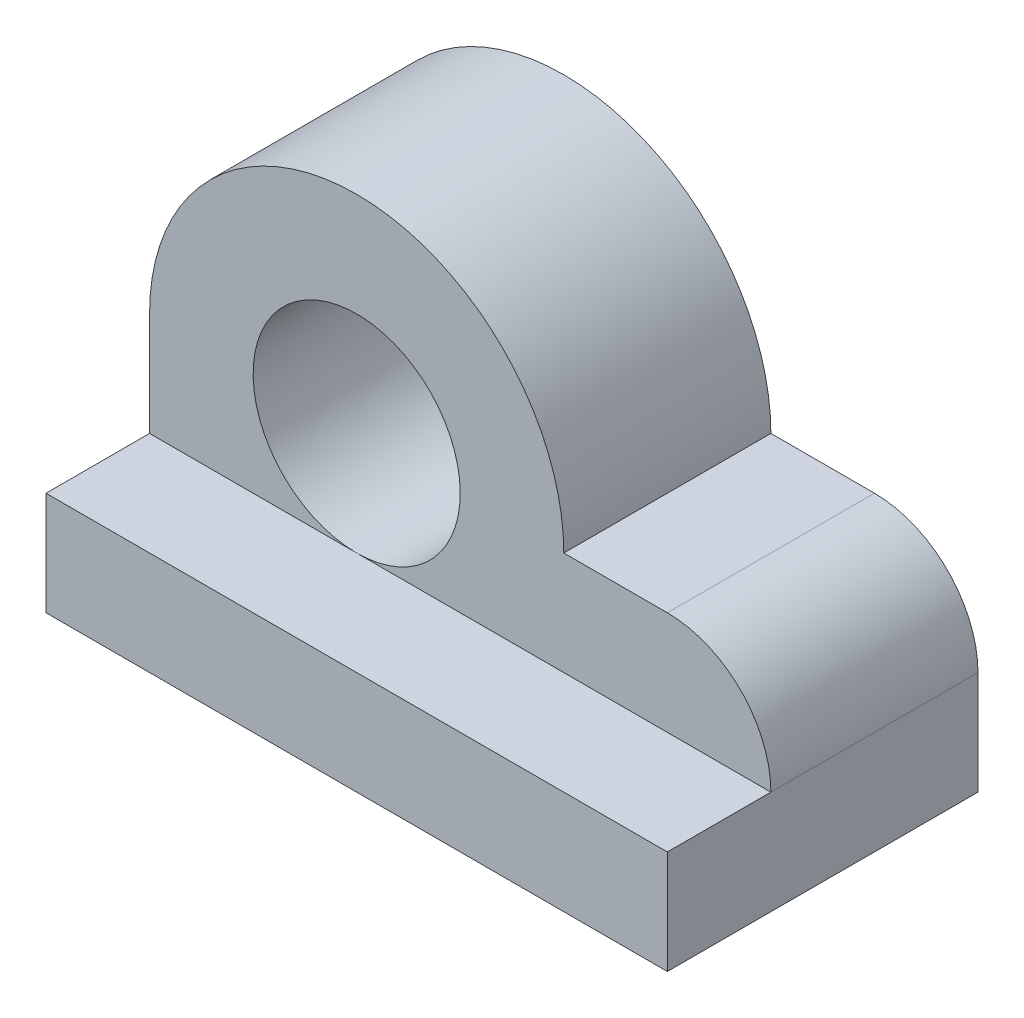
from build123d import *

# Parameters (mm, degrees)
SKETCH_1_W          = 60
SKETCH_1_H          = 10
EXTRUDE_1_DEPTH     = 30
SKETCH_1_3_R        = 5
EXTRUDE_2_DEPTH     = 20
FILLET_1_R          = 10
SKETCH_2_R          = 10
CUT_EXTRUDE_1_DEPTH = 20


with BuildPart() as part:
    # 草圖1 → 填料-伸長1 (new body)
    with BuildSketch(Plane.XY):
        with Locations((30, 5)):
            Rectangle(SKETCH_1_W, SKETCH_1_H)
    extrude(amount=EXTRUDE_1_DEPTH)

    # 草圖1<3> → 填料-伸長2 (add)
    with BuildSketch(Plane.XY):
        with BuildLine():
            Line((0, 20), (0, 10))
            Line((0, 10), (60, 10))
            Line((60, 10), (60, 20))
            Line((60, 20), (40, 20))
            ThreePointArc((40, 20), (20, 40), (0, 20))
        make_face()
        with Locations((20, 20)):
            Circle(SKETCH_1_3_R, mode=Mode.SUBTRACT)
    extrude(amount=EXTRUDE_2_DEPTH)

    # 圓角1
    fillet_1_edges = [part.edges().sort_by_distance(p)[0] for p in [
        (60, 20, 10),
    ]]
    fillet(fillet_1_edges, radius=FILLET_1_R)

    # 草圖2 → 除料-伸長1 (cut)
    with BuildSketch(Plane.XY.offset(20)):
        with Locations((20, 20)):
            Circle(SKETCH_2_R)
    extrude(amount=-CUT_EXTRUDE_1_DEPTH, mode=Mode.SUBTRACT)


solid = part.part
